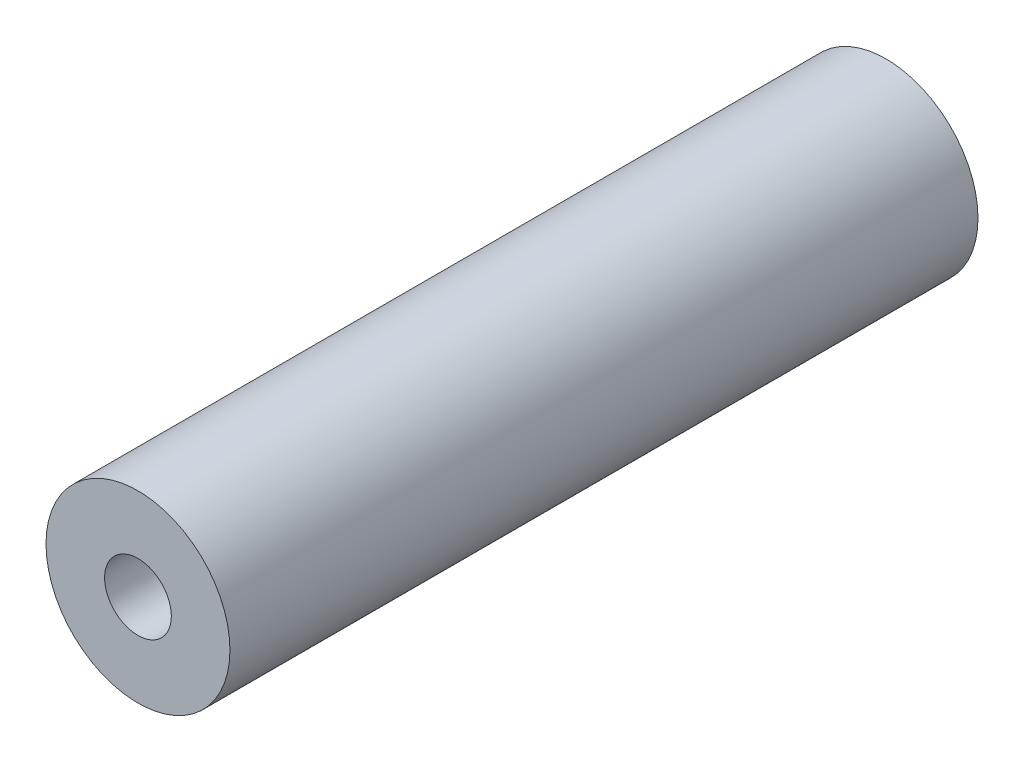
from build123d import *

# Parameters (mm, degrees)
SKETCH1_W                 = 38.735
SKETCH1_H                 = 4.7625
F_8_32_TAPPED_HOLE1_D     = 3.4544
F_8_32_TAPPED_HOLE1_DEPTH = 10.7188
F_8_32_TAPPED_HOLE1_TIP   = 1.037806461
F_8_32_TAPPED_HOLE2_D     = 3.4544
F_8_32_TAPPED_HOLE2_DEPTH = 10.7188
F_8_32_TAPPED_HOLE2_TIP   = 1.037806461


with BuildPart() as part:
    # Sketch1 → Revolve1 (revolve)
    with BuildSketch(Plane(origin=(0, 0, 0), x_dir=(0, 0, -1), z_dir=(1, 0, 0))):
        with Locations((19.3675, 2.38125)):
            Rectangle(SKETCH1_W, SKETCH1_H)
    revolve(axis=Axis((0, 0, 0), (0, 0, 1)))

    # #8-32 Tapped Hole1
    with Locations(Plane.XY):
        with Locations((0, 0)):
            Hole(F_8_32_TAPPED_HOLE1_D / 2, depth=F_8_32_TAPPED_HOLE1_DEPTH)
            with Locations((0, 0, -(F_8_32_TAPPED_HOLE1_DEPTH + F_8_32_TAPPED_HOLE1_TIP / 2))):  # 118° drill point
                Cone(0, F_8_32_TAPPED_HOLE1_D / 2, F_8_32_TAPPED_HOLE1_TIP, mode=Mode.SUBTRACT)

    # #8-32 Tapped Hole2
    with Locations(Plane(origin=(0, 0, -38.735), x_dir=(-1, 0, 0), z_dir=(0, 0, -1))):
        with Locations((0, 0)):
            Hole(F_8_32_TAPPED_HOLE2_D / 2, depth=F_8_32_TAPPED_HOLE2_DEPTH)
            with Locations((0, 0, -(F_8_32_TAPPED_HOLE2_DEPTH + F_8_32_TAPPED_HOLE2_TIP / 2))):  # 118° drill point
                Cone(0, F_8_32_TAPPED_HOLE2_D / 2, F_8_32_TAPPED_HOLE2_TIP, mode=Mode.SUBTRACT)


solid = part.part
